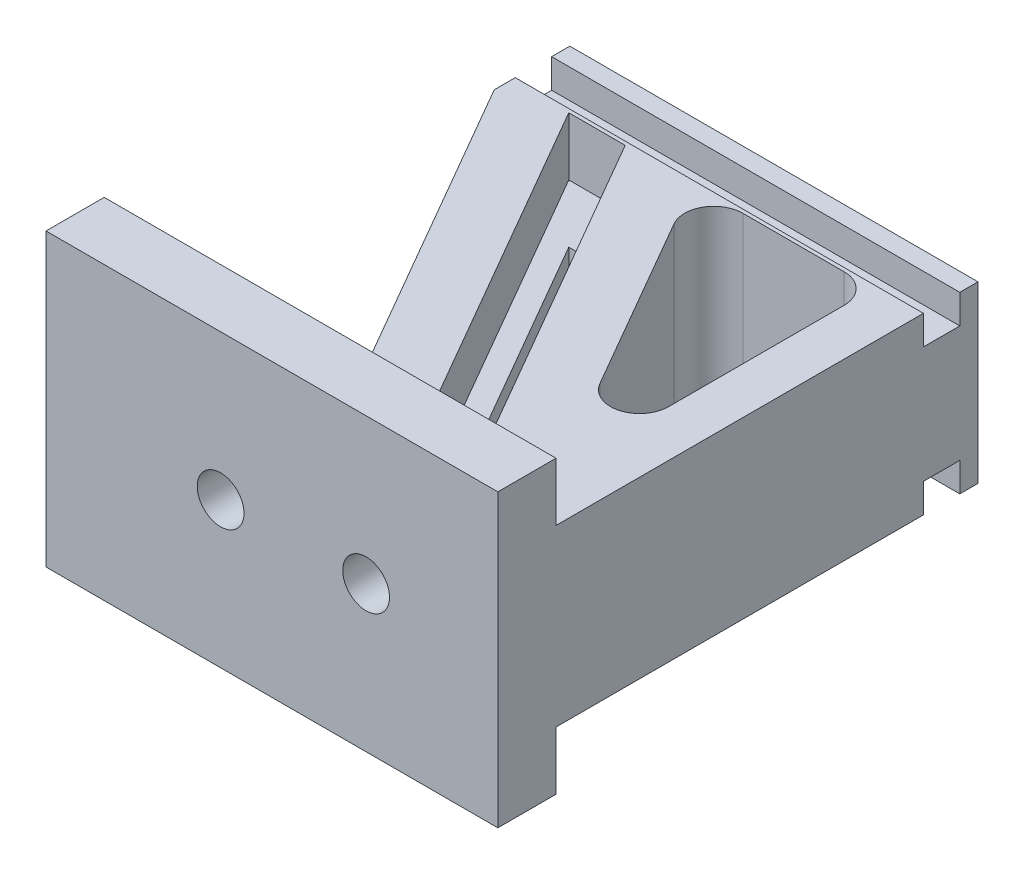
from build123d import *

# Parameters (mm, degrees)
BOSS_EXTRUDE1_DEPTH     = 9.525
SKETCH2_3_W             = 49.295937228
SKETCH2_3_H             = 6.35
BOSS_EXTRUDE2_DEPTH     = 15.875
SKETCH10_W              = 19.05
SKETCH10_H              = 6.35
CUT_EXTRUDE1_DEPTH      = 45.031748726
CUT_EXTRUDE1_DEPTH_BACK = 45.031748726
CUT_EXTRUDE2_DEPTH      = 45.031748726
CUT_EXTRUDE2_DEPTH_BACK = 45.031748726
CUT_EXTRUDE3_REACH      = 62.033
SKETCH14_R              = 2.5527
CUT_EXTRUDE4_DEPTH      = 45.031748726
FILLET1_R               = 3.175
SKETCH17_W              = 3.96875
SKETCH17_H              = 3.175
CUT_EXTRUDE5_DEPTH      = 59.036347156


with BuildPart() as part:
    # Sketch2 → Boss-Extrude1 (new, symmetric)
    with BuildSketch(Plane(origin=(0, 0, 0), x_dir=(1, 0, 0), z_dir=(0, 1, 0))):
        Polygon((24.647968614, 26.19375), (-24.647968614, 26.19375), (1.931794404, -19.84375), (24.647968614, -19.84375), align=None)
    extrude(amount=BOSS_EXTRUDE1_DEPTH, both=True)

    # Sketch2<3> → Boss-Extrude2 (add, symmetric)
    with BuildSketch(Plane(origin=(0, 0, 0), x_dir=(1, 0, 0), z_dir=(0, 1, 0))):
        with Locations((0, -23.01875)):
            Rectangle(SKETCH2_3_W, SKETCH2_3_H)
    extrude(amount=BOSS_EXTRUDE2_DEPTH, both=True)

    # Cut-Sweep1: sweep along a curve in space
    with BuildLine() as cut_sweep1_path:
        Line((-24.647968614, 9.525, -26.19375), (1.931794404, 9.525, 19.84375))
    # Sketch10 → Cut-Sweep1 (sweep, cut)
    with BuildSketch(Plane(origin=(0, 0, -26.19375), x_dir=(-1, 0, 0), z_dir=(0, 0, -1))):
        with Locations((15.122968614, 0)):
            Rectangle(SKETCH10_W, SKETCH10_H)
    sweep(path=cut_sweep1_path.line, mode=Mode.SUBTRACT)

    # Sketch11 → Cut-Extrude1 (cut, two sides: drawn at the far end of the back side and taken through both)
    with BuildSketch(Plane(origin=(0, 9.525, 0), x_dir=(1, 0, 0), z_dir=(0, 1, 0)).offset(-CUT_EXTRUDE1_DEPTH_BACK)):
        Polygon((-19.885468614, 26.19375), (-24.647968614, 26.19375), (-19.885468614, 17.944858029), align=None)
    extrude(amount=CUT_EXTRUDE1_DEPTH + CUT_EXTRUDE1_DEPTH_BACK, mode=Mode.SUBTRACT)

    # Sketch13 → Cut-Extrude2 (cut, two sides: drawn at the far end of the back side and taken through both)
    with BuildSketch(Plane(origin=(0, 9.525, 0), x_dir=(1, 0, 0), z_dir=(0, 1, 0)).offset(-CUT_EXTRUDE2_DEPTH_BACK)):
        Polygon((-13.649445986, 19.84375), (9.264142823, -19.84375), (15.423315495, -19.84375), (-7.490273314, 19.84375), align=None)
    extrude(amount=CUT_EXTRUDE2_DEPTH + CUT_EXTRUDE2_DEPTH_BACK, mode=Mode.SUBTRACT)

    # Sketch14 → Cut-Extrude3 (cut, up to next)
    with BuildSketch(Plane.XY.offset(26.19375), mode=Mode.PRIVATE) as cut_extrude3_sk1:
        with Locations((10.277031386, 0)):
            Circle(SKETCH14_R)
    cut_extrude3_tool1 = extrude(cut_extrude3_sk1.sketch, amount=-CUT_EXTRUDE3_REACH, mode=Mode.PRIVATE) & part.part
    # Sketch14 → Cut-Extrude3 (cut, up to next)
    with BuildSketch(Plane.XY.offset(26.19375), mode=Mode.PRIVATE) as cut_extrude3_sk2:
        with Locations((-5.597968614, 0)):
            Circle(SKETCH14_R)
    cut_extrude3_tool2 = extrude(cut_extrude3_sk2.sketch, amount=-CUT_EXTRUDE3_REACH, mode=Mode.PRIVATE) & part.part
    add(cut_extrude3_tool1.solids().sort_by_distance((10.277031, 0, 26.19375))[0], mode=Mode.SUBTRACT)
    add(cut_extrude3_tool2.solids().sort_by_distance((-5.597969, 0, 26.19375))[0], mode=Mode.SUBTRACT)

    # Sketch16 → Cut-Extrude4 (cut, through all)
    with BuildSketch(Plane(origin=(0, 9.525, 0), x_dir=(1, 0, 0), z_dir=(0, 1, 0))):
        Polygon((-0.157924895, 19.84375), (19.567968614, -14.322499782), (19.567968614, 19.84375), align=None)
    extrude(amount=-CUT_EXTRUDE4_DEPTH, mode=Mode.SUBTRACT)

    # Fillet1
    fillet1_edges = [part.edges().sort_by_distance(p)[0] for p in [
        (19.567968614, 0, 14.322499782),
        (-0.157924895, 0, -19.84375),
        (19.567968614, 0, -19.84375),
    ]]
    fillet(fillet1_edges, radius=FILLET1_R)

    # Sketch17 → Cut-Extrude5 (cut, through all)
    with BuildSketch(Plane(origin=(24.647968614, 0, 0), x_dir=(0, 0, -1), z_dir=(1, 0, 0))):
        with Locations((22.225, 7.9375)):
            Rectangle(SKETCH17_W, SKETCH17_H)
        with Locations((22.225, -7.9375)):
            Rectangle(SKETCH17_W, SKETCH17_H)
    extrude(amount=-CUT_EXTRUDE5_DEPTH, mode=Mode.SUBTRACT)


solid = part.part
